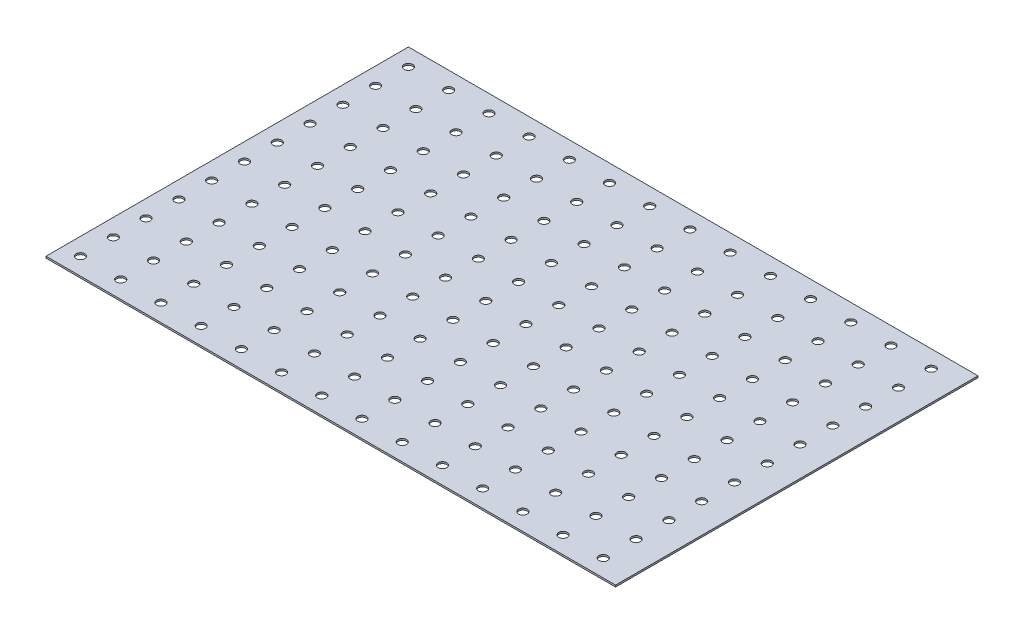
from build123d import *

# Parameters (mm, degrees)
SKETCH1_W           = 330
SKETCH1_H           = 210
SKETCH1_R           = 2.5
BOSS_EXTRUDE1_DEPTH = 1


with BuildPart() as part:
    # Sketch1 → Boss-Extrude1 (new body)
    with BuildSketch(Plane(origin=(0, 0, 0), x_dir=(1, 0, 0), z_dir=(0, 1, 0))):
        with Locations((-43.359375, -6.15234375)):
            Rectangle(SKETCH1_W, SKETCH1_H)
        with Locations(Location((-198.359375, 88.84765625, 0), (0, 0, 270))):
            Circle(SKETCH1_R, mode=Mode.SUBTRACT)
        with Locations(Location((-175.059375, 88.84765625, 0), (0, 0, 270))):
            Circle(SKETCH1_R, mode=Mode.SUBTRACT)
        with Locations(Location((-151.759375, 88.84765625, 0), (0, 0, 270))):
            Circle(SKETCH1_R, mode=Mode.SUBTRACT)
        with Locations(Location((-128.459375, 88.84765625, 0), (0, 0, 270))):
            Circle(SKETCH1_R, mode=Mode.SUBTRACT)
        with Locations(Location((-105.159375, 88.84765625, 0), (0, 0, 270))):
            Circle(SKETCH1_R, mode=Mode.SUBTRACT)
        with Locations(Location((-81.859375, 88.84765625, 0), (0, 0, 270))):
            Circle(SKETCH1_R, mode=Mode.SUBTRACT)
        with Locations(Location((-58.559375, 88.84765625, 0), (0, 0, 270))):
            Circle(SKETCH1_R, mode=Mode.SUBTRACT)
        with Locations(Location((-35.259375, 88.84765625, 0), (0, 0, 270))):
            Circle(SKETCH1_R, mode=Mode.SUBTRACT)
        with Locations(Location((-11.959375, 88.84765625, 0), (0, 0, 270))):
            Circle(SKETCH1_R, mode=Mode.SUBTRACT)
        with Locations(Location((11.340625, 88.84765625, 0), (0, 0, 270))):
            Circle(SKETCH1_R, mode=Mode.SUBTRACT)
        with Locations(Location((34.640625, 88.84765625, 0), (0, 0, 270))):
            Circle(SKETCH1_R, mode=Mode.SUBTRACT)
        with Locations(Location((57.940625, 88.84765625, 0), (0, 0, 270))):
            Circle(SKETCH1_R, mode=Mode.SUBTRACT)
        with Locations(Location((81.240625, 88.84765625, 0), (0, 0, 270))):
            Circle(SKETCH1_R, mode=Mode.SUBTRACT)
        with Locations(Location((104.540625, 88.84765625, 0), (0, 0, 270))):
            Circle(SKETCH1_R, mode=Mode.SUBTRACT)
        with Locations(Location((-175.059375, 69.84765625, 0), (0, 0, 270))):
            Circle(SKETCH1_R, mode=Mode.SUBTRACT)
        with Locations(Location((-151.759375, 69.84765625, 0), (0, 0, 270))):
            Circle(SKETCH1_R, mode=Mode.SUBTRACT)
        with Locations(Location((-128.459375, 69.84765625, 0), (0, 0, 270))):
            Circle(SKETCH1_R, mode=Mode.SUBTRACT)
        with Locations(Location((-105.159375, 69.84765625, 0), (0, 0, 270))):
            Circle(SKETCH1_R, mode=Mode.SUBTRACT)
        with Locations(Location((-81.859375, 69.84765625, 0), (0, 0, 270))):
            Circle(SKETCH1_R, mode=Mode.SUBTRACT)
        with Locations(Location((-58.559375, 69.84765625, 0), (0, 0, 270))):
            Circle(SKETCH1_R, mode=Mode.SUBTRACT)
        with Locations(Location((-35.259375, 69.84765625, 0), (0, 0, 270))):
            Circle(SKETCH1_R, mode=Mode.SUBTRACT)
        with Locations(Location((-11.959375, 69.84765625, 0), (0, 0, 270))):
            Circle(SKETCH1_R, mode=Mode.SUBTRACT)
        with Locations(Location((11.340625, 69.84765625, 0), (0, 0, 270))):
            Circle(SKETCH1_R, mode=Mode.SUBTRACT)
        with Locations(Location((34.640625, 69.84765625, 0), (0, 0, 270))):
            Circle(SKETCH1_R, mode=Mode.SUBTRACT)
        with Locations(Location((57.940625, 69.84765625, 0), (0, 0, 270))):
            Circle(SKETCH1_R, mode=Mode.SUBTRACT)
        with Locations(Location((81.240625, 69.84765625, 0), (0, 0, 270))):
            Circle(SKETCH1_R, mode=Mode.SUBTRACT)
        with Locations(Location((104.540625, 69.84765625, 0), (0, 0, 270))):
            Circle(SKETCH1_R, mode=Mode.SUBTRACT)
        with Locations(Location((-175.059375, 50.84765625, 0), (0, 0, 270))):
            Circle(SKETCH1_R, mode=Mode.SUBTRACT)
        with Locations(Location((-151.759375, 50.84765625, 0), (0, 0, 270))):
            Circle(SKETCH1_R, mode=Mode.SUBTRACT)
        with Locations(Location((-128.459375, 50.84765625, 0), (0, 0, 270))):
            Circle(SKETCH1_R, mode=Mode.SUBTRACT)
        with Locations(Location((-105.159375, 50.84765625, 0), (0, 0, 270))):
            Circle(SKETCH1_R, mode=Mode.SUBTRACT)
        with Locations(Location((-81.859375, 50.84765625, 0), (0, 0, 270))):
            Circle(SKETCH1_R, mode=Mode.SUBTRACT)
        with Locations(Location((-58.559375, 50.84765625, 0), (0, 0, 270))):
            Circle(SKETCH1_R, mode=Mode.SUBTRACT)
        with Locations(Location((-35.259375, 50.84765625, 0), (0, 0, 270))):
            Circle(SKETCH1_R, mode=Mode.SUBTRACT)
        with Locations(Location((-11.959375, 50.84765625, 0), (0, 0, 270))):
            Circle(SKETCH1_R, mode=Mode.SUBTRACT)
        with Locations(Location((11.340625, 50.84765625, 0), (0, 0, 270))):
            Circle(SKETCH1_R, mode=Mode.SUBTRACT)
        with Locations(Location((34.640625, 50.84765625, 0), (0, 0, 270))):
            Circle(SKETCH1_R, mode=Mode.SUBTRACT)
        with Locations(Location((57.940625, 50.84765625, 0), (0, 0, 270))):
            Circle(SKETCH1_R, mode=Mode.SUBTRACT)
        with Locations(Location((81.240625, 50.84765625, 0), (0, 0, 270))):
            Circle(SKETCH1_R, mode=Mode.SUBTRACT)
        with Locations(Location((104.540625, 50.84765625, 0), (0, 0, 270))):
            Circle(SKETCH1_R, mode=Mode.SUBTRACT)
        with Locations(Location((-175.059375, 31.84765625, 0), (0, 0, 270))):
            Circle(SKETCH1_R, mode=Mode.SUBTRACT)
        with Locations(Location((-151.759375, 31.84765625, 0), (0, 0, 270))):
            Circle(SKETCH1_R, mode=Mode.SUBTRACT)
        with Locations(Location((-128.459375, 31.84765625, 0), (0, 0, 270))):
            Circle(SKETCH1_R, mode=Mode.SUBTRACT)
        with Locations(Location((-105.159375, 31.84765625, 0), (0, 0, 270))):
            Circle(SKETCH1_R, mode=Mode.SUBTRACT)
        with Locations(Location((-81.859375, 31.84765625, 0), (0, 0, 270))):
            Circle(SKETCH1_R, mode=Mode.SUBTRACT)
        with Locations(Location((-58.559375, 31.84765625, 0), (0, 0, 270))):
            Circle(SKETCH1_R, mode=Mode.SUBTRACT)
        with Locations(Location((-35.259375, 31.84765625, 0), (0, 0, 270))):
            Circle(SKETCH1_R, mode=Mode.SUBTRACT)
        with Locations(Location((-11.959375, 31.84765625, 0), (0, 0, 270))):
            Circle(SKETCH1_R, mode=Mode.SUBTRACT)
        with Locations(Location((11.340625, 31.84765625, 0), (0, 0, 270))):
            Circle(SKETCH1_R, mode=Mode.SUBTRACT)
        with Locations(Location((34.640625, 31.84765625, 0), (0, 0, 270))):
            Circle(SKETCH1_R, mode=Mode.SUBTRACT)
        with Locations(Location((57.940625, 31.84765625, 0), (0, 0, 270))):
            Circle(SKETCH1_R, mode=Mode.SUBTRACT)
        with Locations(Location((81.240625, 31.84765625, 0), (0, 0, 270))):
            Circle(SKETCH1_R, mode=Mode.SUBTRACT)
        with Locations(Location((104.540625, 31.84765625, 0), (0, 0, 270))):
            Circle(SKETCH1_R, mode=Mode.SUBTRACT)
        with Locations(Location((-175.059375, 12.84765625, 0), (0, 0, 270))):
            Circle(SKETCH1_R, mode=Mode.SUBTRACT)
        with Locations(Location((-151.759375, 12.84765625, 0), (0, 0, 270))):
            Circle(SKETCH1_R, mode=Mode.SUBTRACT)
        with Locations(Location((-128.459375, 12.84765625, 0), (0, 0, 270))):
            Circle(SKETCH1_R, mode=Mode.SUBTRACT)
        with Locations(Location((-105.159375, 12.84765625, 0), (0, 0, 270))):
            Circle(SKETCH1_R, mode=Mode.SUBTRACT)
        with Locations(Location((-81.859375, 12.84765625, 0), (0, 0, 270))):
            Circle(SKETCH1_R, mode=Mode.SUBTRACT)
        with Locations(Location((-58.559375, 12.84765625, 0), (0, 0, 270))):
            Circle(SKETCH1_R, mode=Mode.SUBTRACT)
        with Locations(Location((-35.259375, 12.84765625, 0), (0, 0, 270))):
            Circle(SKETCH1_R, mode=Mode.SUBTRACT)
        with Locations(Location((-11.959375, 12.84765625, 0), (0, 0, 270))):
            Circle(SKETCH1_R, mode=Mode.SUBTRACT)
        with Locations(Location((11.340625, 12.84765625, 0), (0, 0, 270))):
            Circle(SKETCH1_R, mode=Mode.SUBTRACT)
        with Locations(Location((34.640625, 12.84765625, 0), (0, 0, 270))):
            Circle(SKETCH1_R, mode=Mode.SUBTRACT)
        with Locations(Location((57.940625, 12.84765625, 0), (0, 0, 270))):
            Circle(SKETCH1_R, mode=Mode.SUBTRACT)
        with Locations(Location((81.240625, 12.84765625, 0), (0, 0, 270))):
            Circle(SKETCH1_R, mode=Mode.SUBTRACT)
        with Locations(Location((104.540625, 12.84765625, 0), (0, 0, 270))):
            Circle(SKETCH1_R, mode=Mode.SUBTRACT)
        with Locations(Location((-175.059375, -6.15234375, 0), (0, 0, 270))):
            Circle(SKETCH1_R, mode=Mode.SUBTRACT)
        with Locations(Location((-151.759375, -6.15234375, 0), (0, 0, 270))):
            Circle(SKETCH1_R, mode=Mode.SUBTRACT)
        with Locations(Location((-128.459375, -6.15234375, 0), (0, 0, 270))):
            Circle(SKETCH1_R, mode=Mode.SUBTRACT)
        with Locations(Location((-105.159375, -6.15234375, 0), (0, 0, 270))):
            Circle(SKETCH1_R, mode=Mode.SUBTRACT)
        with Locations(Location((-81.859375, -6.15234375, 0), (0, 0, 270))):
            Circle(SKETCH1_R, mode=Mode.SUBTRACT)
        with Locations(Location((-58.559375, -6.15234375, 0), (0, 0, 270))):
            Circle(SKETCH1_R, mode=Mode.SUBTRACT)
        with Locations(Location((-35.259375, -6.15234375, 0), (0, 0, 270))):
            Circle(SKETCH1_R, mode=Mode.SUBTRACT)
        with Locations(Location((-11.959375, -6.15234375, 0), (0, 0, 270))):
            Circle(SKETCH1_R, mode=Mode.SUBTRACT)
        with Locations(Location((11.340625, -6.15234375, 0), (0, 0, 270))):
            Circle(SKETCH1_R, mode=Mode.SUBTRACT)
        with Locations(Location((34.640625, -6.15234375, 0), (0, 0, 270))):
            Circle(SKETCH1_R, mode=Mode.SUBTRACT)
        with Locations(Location((57.940625, -6.15234375, 0), (0, 0, 270))):
            Circle(SKETCH1_R, mode=Mode.SUBTRACT)
        with Locations(Location((81.240625, -6.15234375, 0), (0, 0, 270))):
            Circle(SKETCH1_R, mode=Mode.SUBTRACT)
        with Locations(Location((104.540625, -6.15234375, 0), (0, 0, 270))):
            Circle(SKETCH1_R, mode=Mode.SUBTRACT)
        with Locations(Location((-175.059375, -25.15234375, 0), (0, 0, 270))):
            Circle(SKETCH1_R, mode=Mode.SUBTRACT)
        with Locations(Location((-151.759375, -25.15234375, 0), (0, 0, 270))):
            Circle(SKETCH1_R, mode=Mode.SUBTRACT)
        with Locations(Location((-128.459375, -25.15234375, 0), (0, 0, 270))):
            Circle(SKETCH1_R, mode=Mode.SUBTRACT)
        with Locations(Location((-105.159375, -25.15234375, 0), (0, 0, 270))):
            Circle(SKETCH1_R, mode=Mode.SUBTRACT)
        with Locations(Location((-81.859375, -25.15234375, 0), (0, 0, 270))):
            Circle(SKETCH1_R, mode=Mode.SUBTRACT)
        with Locations(Location((-58.559375, -25.15234375, 0), (0, 0, 270))):
            Circle(SKETCH1_R, mode=Mode.SUBTRACT)
        with Locations(Location((-35.259375, -25.15234375, 0), (0, 0, 270))):
            Circle(SKETCH1_R, mode=Mode.SUBTRACT)
        with Locations(Location((-11.959375, -25.15234375, 0), (0, 0, 270))):
            Circle(SKETCH1_R, mode=Mode.SUBTRACT)
        with Locations(Location((11.340625, -25.15234375, 0), (0, 0, 270))):
            Circle(SKETCH1_R, mode=Mode.SUBTRACT)
        with Locations(Location((34.640625, -25.15234375, 0), (0, 0, 270))):
            Circle(SKETCH1_R, mode=Mode.SUBTRACT)
        with Locations(Location((57.940625, -25.15234375, 0), (0, 0, 270))):
            Circle(SKETCH1_R, mode=Mode.SUBTRACT)
        with Locations(Location((81.240625, -25.15234375, 0), (0, 0, 270))):
            Circle(SKETCH1_R, mode=Mode.SUBTRACT)
        with Locations(Location((104.540625, -25.15234375, 0), (0, 0, 270))):
            Circle(SKETCH1_R, mode=Mode.SUBTRACT)
        with Locations(Location((-175.059375, -44.15234375, 0), (0, 0, 270))):
            Circle(SKETCH1_R, mode=Mode.SUBTRACT)
        with Locations(Location((-151.759375, -44.15234375, 0), (0, 0, 270))):
            Circle(SKETCH1_R, mode=Mode.SUBTRACT)
        with Locations(Location((-128.459375, -44.15234375, 0), (0, 0, 270))):
            Circle(SKETCH1_R, mode=Mode.SUBTRACT)
        with Locations(Location((-105.159375, -44.15234375, 0), (0, 0, 270))):
            Circle(SKETCH1_R, mode=Mode.SUBTRACT)
        with Locations(Location((-81.859375, -44.15234375, 0), (0, 0, 270))):
            Circle(SKETCH1_R, mode=Mode.SUBTRACT)
        with Locations(Location((-58.559375, -44.15234375, 0), (0, 0, 270))):
            Circle(SKETCH1_R, mode=Mode.SUBTRACT)
        with Locations(Location((-35.259375, -44.15234375, 0), (0, 0, 270))):
            Circle(SKETCH1_R, mode=Mode.SUBTRACT)
        with Locations(Location((-11.959375, -44.15234375, 0), (0, 0, 270))):
            Circle(SKETCH1_R, mode=Mode.SUBTRACT)
        with Locations(Location((11.340625, -44.15234375, 0), (0, 0, 270))):
            Circle(SKETCH1_R, mode=Mode.SUBTRACT)
        with Locations(Location((34.640625, -44.15234375, 0), (0, 0, 270))):
            Circle(SKETCH1_R, mode=Mode.SUBTRACT)
        with Locations(Location((57.940625, -44.15234375, 0), (0, 0, 270))):
            Circle(SKETCH1_R, mode=Mode.SUBTRACT)
        with Locations(Location((81.240625, -44.15234375, 0), (0, 0, 270))):
            Circle(SKETCH1_R, mode=Mode.SUBTRACT)
        with Locations(Location((104.540625, -44.15234375, 0), (0, 0, 270))):
            Circle(SKETCH1_R, mode=Mode.SUBTRACT)
        with Locations(Location((-175.059375, -63.15234375, 0), (0, 0, 270))):
            Circle(SKETCH1_R, mode=Mode.SUBTRACT)
        with Locations(Location((-151.759375, -63.15234375, 0), (0, 0, 270))):
            Circle(SKETCH1_R, mode=Mode.SUBTRACT)
        with Locations(Location((-128.459375, -63.15234375, 0), (0, 0, 270))):
            Circle(SKETCH1_R, mode=Mode.SUBTRACT)
        with Locations(Location((-105.159375, -63.15234375, 0), (0, 0, 270))):
            Circle(SKETCH1_R, mode=Mode.SUBTRACT)
        with Locations(Location((-81.859375, -63.15234375, 0), (0, 0, 270))):
            Circle(SKETCH1_R, mode=Mode.SUBTRACT)
        with Locations(Location((-58.559375, -63.15234375, 0), (0, 0, 270))):
            Circle(SKETCH1_R, mode=Mode.SUBTRACT)
        with Locations(Location((-35.259375, -63.15234375, 0), (0, 0, 270))):
            Circle(SKETCH1_R, mode=Mode.SUBTRACT)
        with Locations(Location((-11.959375, -63.15234375, 0), (0, 0, 270))):
            Circle(SKETCH1_R, mode=Mode.SUBTRACT)
        with Locations(Location((11.340625, -63.15234375, 0), (0, 0, 270))):
            Circle(SKETCH1_R, mode=Mode.SUBTRACT)
        with Locations(Location((34.640625, -63.15234375, 0), (0, 0, 270))):
            Circle(SKETCH1_R, mode=Mode.SUBTRACT)
        with Locations(Location((57.940625, -63.15234375, 0), (0, 0, 270))):
            Circle(SKETCH1_R, mode=Mode.SUBTRACT)
        with Locations(Location((81.240625, -63.15234375, 0), (0, 0, 270))):
            Circle(SKETCH1_R, mode=Mode.SUBTRACT)
        with Locations(Location((104.540625, -63.15234375, 0), (0, 0, 270))):
            Circle(SKETCH1_R, mode=Mode.SUBTRACT)
        with Locations(Location((-175.059375, -82.15234375, 0), (0, 0, 270))):
            Circle(SKETCH1_R, mode=Mode.SUBTRACT)
        with Locations(Location((-151.759375, -82.15234375, 0), (0, 0, 270))):
            Circle(SKETCH1_R, mode=Mode.SUBTRACT)
        with Locations(Location((-128.459375, -82.15234375, 0), (0, 0, 270))):
            Circle(SKETCH1_R, mode=Mode.SUBTRACT)
        with Locations(Location((-105.159375, -82.15234375, 0), (0, 0, 270))):
            Circle(SKETCH1_R, mode=Mode.SUBTRACT)
        with Locations(Location((-81.859375, -82.15234375, 0), (0, 0, 270))):
            Circle(SKETCH1_R, mode=Mode.SUBTRACT)
        with Locations(Location((-58.559375, -82.15234375, 0), (0, 0, 270))):
            Circle(SKETCH1_R, mode=Mode.SUBTRACT)
        with Locations(Location((-35.259375, -82.15234375, 0), (0, 0, 270))):
            Circle(SKETCH1_R, mode=Mode.SUBTRACT)
        with Locations(Location((-11.959375, -82.15234375, 0), (0, 0, 270))):
            Circle(SKETCH1_R, mode=Mode.SUBTRACT)
        with Locations(Location((11.340625, -82.15234375, 0), (0, 0, 270))):
            Circle(SKETCH1_R, mode=Mode.SUBTRACT)
        with Locations(Location((34.640625, -82.15234375, 0), (0, 0, 270))):
            Circle(SKETCH1_R, mode=Mode.SUBTRACT)
        with Locations(Location((57.940625, -82.15234375, 0), (0, 0, 270))):
            Circle(SKETCH1_R, mode=Mode.SUBTRACT)
        with Locations(Location((81.240625, -82.15234375, 0), (0, 0, 270))):
            Circle(SKETCH1_R, mode=Mode.SUBTRACT)
        with Locations(Location((104.540625, -82.15234375, 0), (0, 0, 270))):
            Circle(SKETCH1_R, mode=Mode.SUBTRACT)
        with Locations(Location((-175.059375, -101.15234375, 0), (0, 0, 270))):
            Circle(SKETCH1_R, mode=Mode.SUBTRACT)
        with Locations(Location((-151.759375, -101.15234375, 0), (0, 0, 270))):
            Circle(SKETCH1_R, mode=Mode.SUBTRACT)
        with Locations(Location((-128.459375, -101.15234375, 0), (0, 0, 270))):
            Circle(SKETCH1_R, mode=Mode.SUBTRACT)
        with Locations(Location((-105.159375, -101.15234375, 0), (0, 0, 270))):
            Circle(SKETCH1_R, mode=Mode.SUBTRACT)
        with Locations(Location((-81.859375, -101.15234375, 0), (0, 0, 270))):
            Circle(SKETCH1_R, mode=Mode.SUBTRACT)
        with Locations(Location((-58.559375, -101.15234375, 0), (0, 0, 270))):
            Circle(SKETCH1_R, mode=Mode.SUBTRACT)
        with Locations(Location((-35.259375, -101.15234375, 0), (0, 0, 270))):
            Circle(SKETCH1_R, mode=Mode.SUBTRACT)
        with Locations(Location((-11.959375, -101.15234375, 0), (0, 0, 270))):
            Circle(SKETCH1_R, mode=Mode.SUBTRACT)
        with Locations(Location((11.340625, -101.15234375, 0), (0, 0, 270))):
            Circle(SKETCH1_R, mode=Mode.SUBTRACT)
        with Locations(Location((34.640625, -101.15234375, 0), (0, 0, 270))):
            Circle(SKETCH1_R, mode=Mode.SUBTRACT)
        with Locations(Location((57.940625, -101.15234375, 0), (0, 0, 270))):
            Circle(SKETCH1_R, mode=Mode.SUBTRACT)
        with Locations(Location((81.240625, -101.15234375, 0), (0, 0, 270))):
            Circle(SKETCH1_R, mode=Mode.SUBTRACT)
        with Locations(Location((104.540625, -101.15234375, 0), (0, 0, 270))):
            Circle(SKETCH1_R, mode=Mode.SUBTRACT)
        with Locations(Location((-198.359375, 69.84765625, 0), (0, 0, 270))):
            Circle(SKETCH1_R, mode=Mode.SUBTRACT)
        with Locations(Location((-198.359375, 50.84765625, 0), (0, 0, 270))):
            Circle(SKETCH1_R, mode=Mode.SUBTRACT)
        with Locations(Location((-198.359375, 31.84765625, 0), (0, 0, 270))):
            Circle(SKETCH1_R, mode=Mode.SUBTRACT)
        with Locations(Location((-198.359375, 12.84765625, 0), (0, 0, 270))):
            Circle(SKETCH1_R, mode=Mode.SUBTRACT)
        with Locations(Location((-198.359375, -6.15234375, 0), (0, 0, 270))):
            Circle(SKETCH1_R, mode=Mode.SUBTRACT)
        with Locations(Location((-198.359375, -25.15234375, 0), (0, 0, 270))):
            Circle(SKETCH1_R, mode=Mode.SUBTRACT)
        with Locations(Location((-198.359375, -44.15234375, 0), (0, 0, 270))):
            Circle(SKETCH1_R, mode=Mode.SUBTRACT)
        with Locations(Location((-198.359375, -63.15234375, 0), (0, 0, 270))):
            Circle(SKETCH1_R, mode=Mode.SUBTRACT)
        with Locations(Location((-198.359375, -82.15234375, 0), (0, 0, 270))):
            Circle(SKETCH1_R, mode=Mode.SUBTRACT)
        with Locations(Location((-198.359375, -101.15234375, 0), (0, 0, 270))):
            Circle(SKETCH1_R, mode=Mode.SUBTRACT)
    extrude(amount=BOSS_EXTRUDE1_DEPTH)


solid = part.part
